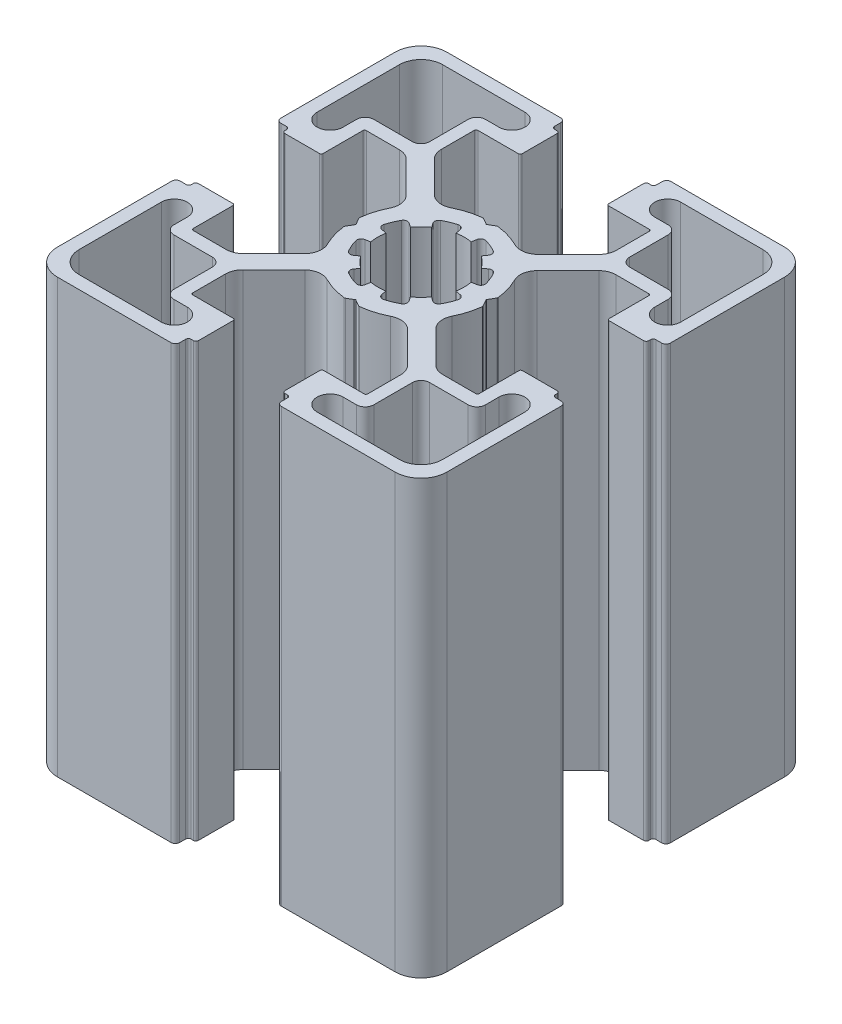
from build123d import *

# Parameters (mm, degrees)
BOSS_EXTRUDE1_DEPTH = 50


with BuildPart() as part:
    # Sketch1 → Boss-Extrude1 (new body)
    with BuildSketch(Plane(origin=(0, 0, 0), x_dir=(1, 0, 0), z_dir=(0, 1, 0))):
        with BuildLine():
            Line((7.563483841, 5.858695924), (11.129779796, 9.424987881))
            ThreePointArc((11.129779796, 9.424987881), (11.76062452, 9.846504465), (12.504756421, 9.994521395))
            Line((12.504756421, 9.994521395), (16.316902359, 9.994521395))
            ThreePointArc((16.316902359, 9.994521395), (16.458323963, 9.935942648), (16.51690271, 9.794521044))
            Line((16.51690271, 9.794521044), (16.51690271, 5.20001408))
            ThreePointArc((16.51690271, 5.20001408), (16.575481456, 5.058592476), (16.716903061, 5.000013729))
            Line((16.716903061, 5.000013729), (20.719599813, 5.000013729))
            ThreePointArc((20.719599813, 5.000013729), (20.931731335, 5.087881483), (21.019599089, 5.300013005))
            Line((21.019599089, 5.300013005), (21.019599089, 5.500003954))
            ThreePointArc((21.019599089, 5.500003954), (21.107466988, 5.71213583), (21.319598864, 5.800003729))
            Line((21.319598864, 5.800003729), (21.999979422, 5.800003729))
            ThreePointArc((21.999979422, 5.800003729), (22.353532548, 5.946450229), (22.499979048, 6.300003356))
            Line((22.499979048, 6.300003356), (22.499979048, 19.500015971))
            ThreePointArc((22.499979048, 19.500015971), (21.621300048, 21.62133473), (19.499981289, 22.50001373))
            Line((19.499981289, 22.50001373), (6.37570892, 22.50001373))
            ThreePointArc((6.37570892, 22.50001373), (6.022155794, 22.35356723), (5.875709294, 22.000014103))
            Line((5.875709294, 22.000014103), (5.875709294, 21.300013005))
            ThreePointArc((5.875709294, 21.300013005), (5.78784154, 21.087881482), (5.575710018, 21.000013729))
            Line((5.575710018, 21.000013729), (5.299998684, 21.000013729))
            ThreePointArc((5.299998684, 21.000013729), (5.087867516, 20.912146122), (4.999999909, 20.700014953))
            Line((4.999999909, 20.700014953), (4.999999909, 16.666812288))
            ThreePointArc((4.999999909, 16.666812288), (5.058578802, 16.52539033), (5.20000076, 16.466811437))
            Line((5.20000076, 16.466811437), (9.905385127, 16.466811437))
            ThreePointArc((9.905385127, 16.466811437), (10.046806731, 16.408232691), (10.105385478, 16.266811086))
            Line((10.105385478, 16.266811086), (10.105385478, 12.471582811))
            ThreePointArc((10.105385478, 12.471582811), (9.953144497, 11.706215717), (9.519598864, 11.057368824))
            Line((9.519598864, 11.057368824), (5.944897897, 7.482667857))
            ThreePointArc((5.944897897, 7.482667857), (4.854602604, 6.96783564), (3.666501718, 7.17329201))
            ThreePointArc((3.666501718, 7.17329201), (2.308631207, 7.714000899), (0.875344921, 8.000128222))
            ThreePointArc((0.875344921, 8.000128222), (0.813048151, 7.996979672), (0.754751151, 7.974792726))
            Line((0.754751151, 7.974792726), (0.112630526, 7.606936313))
            ThreePointArc((0.112630526, 7.606936313), (0.062965968, 7.559088119), (2.065e-06, 7.530953356))
            ThreePointArc((2.065e-06, 7.530953356), (-0.062961837, 7.559088119), (-0.112626394, 7.606936313))
            Line((-0.112626394, 7.606936313), (-0.754745572, 7.974791896))
            ThreePointArc((-0.754745572, 7.974791896), (-0.813042564, 7.99697884), (-0.875339325, 8.000127394))
            ThreePointArc((-0.875339325, 8.000127394), (-2.308625867, 7.714000103), (-3.666496612, 7.173291142))
            ThreePointArc((-3.666496612, 7.173291142), (-4.854599203, 6.967834938), (-5.944895348, 7.482669215))
            Line((-5.944895348, 7.482669215), (-9.519596331, 11.057370197))
            ThreePointArc((-9.519596331, 11.057370197), (-9.953141964, 11.70621709), (-10.105382945, 12.471584185))
            Line((-10.105382945, 12.471584185), (-10.105382945, 16.266811086))
            ThreePointArc((-10.105382945, 16.266811086), (-10.046804198, 16.408232691), (-9.905382594, 16.466811437))
            Line((-9.905382594, 16.466811437), (-5.200000942, 16.466811437))
            ThreePointArc((-5.200000942, 16.466811437), (-5.058578984, 16.52539033), (-5.000000091, 16.666812288))
            Line((-5.000000091, 16.666812288), (-5.000000091, 20.700014953))
            ThreePointArc((-5.000000091, 20.700014953), (-5.087867699, 20.912146122), (-5.299998867, 21.000013729))
            Line((-5.299998867, 21.000013729), (-5.575710202, 21.000013729))
            ThreePointArc((-5.575710202, 21.000013729), (-5.787841724, 21.087881482), (-5.875709478, 21.300013005))
            Line((-5.875709478, 21.300013005), (-5.875709478, 22.000014104))
            ThreePointArc((-5.875709478, 22.000014104), (-6.022155978, 22.35356723), (-6.375709104, 22.50001373))
            Line((-6.375709104, 22.50001373), (-19.499981473, 22.50001373))
            ThreePointArc((-19.499981473, 22.50001373), (-21.621300232, 21.62133473), (-22.499979232, 19.500015971))
            Line((-22.499979232, 19.500015971), (-22.499979232, 6.300003356))
            ThreePointArc((-22.499979232, 6.300003356), (-22.353532732, 5.946450229), (-21.999979605, 5.800003729))
            Line((-21.999979605, 5.800003729), (-21.319599047, 5.800003729))
            ThreePointArc((-21.319599047, 5.800003729), (-21.107467171, 5.71213583), (-21.019599271, 5.500003954))
            Line((-21.019599271, 5.500003954), (-21.019599271, 5.300013005))
            ThreePointArc((-21.019599271, 5.300013005), (-20.931731518, 5.087881483), (-20.719599995, 5.000013729))
            Line((-20.719599995, 5.000013729), (-16.716903244, 5.000013729))
            ThreePointArc((-16.716903244, 5.000013729), (-16.57548164, 5.058592476), (-16.516902894, 5.20001408))
            Line((-16.516902894, 5.20001408), (-16.516902894, 9.794521044))
            ThreePointArc((-16.516902894, 9.794521044), (-16.458324147, 9.935942648), (-16.316902543, 9.994521395))
            Line((-16.316902543, 9.994521395), (-12.504755574, 9.994521395))
            ThreePointArc((-12.504755574, 9.994521395), (-11.760623673, 9.846504465), (-11.129778949, 9.424987881))
            Line((-11.129778949, 9.424987881), (-7.563484024, 5.858696956))
            ThreePointArc((-7.563484024, 5.858696956), (-7.018857309, 4.793955357), (-7.200363541, 3.611860429))
            ThreePointArc((-7.200363541, 3.611860429), (-7.719534914, 2.299057702), (-7.999860794, 0.915436613))
            ThreePointArc((-7.999860794, 0.915436613), (-7.996805132, 0.851929863), (-7.97397167, 0.792591196))
            Line((-7.97397167, 0.792591196), (-7.540055962, 0.046829926))
            ThreePointArc((-7.540055962, 0.046829926), (-7.534291471, 0.023676009), (-7.531325428, 3.7e-07))
            ThreePointArc((-7.531325428, 3.7e-07), (-7.534291471, -0.023675268), (-7.540055962, -0.046829185))
            Line((-7.540055962, -0.046829185), (-7.97397167, -0.792590455))
            ThreePointArc((-7.97397167, -0.792590455), (-7.996805132, -0.851929122), (-7.999860794, -0.915435872))
            ThreePointArc((-7.999860794, -0.915435872), (-7.719534914, -2.299056961), (-7.200363541, -3.611859688))
            ThreePointArc((-7.200363541, -3.611859688), (-7.018857309, -4.793954616), (-7.563484024, -5.858696215))
            Line((-7.563484024, -5.858696215), (-11.12977998, -9.424988171))
            ThreePointArc((-11.12977998, -9.424988171), (-11.760624704, -9.846504756), (-12.504756605, -9.994521685))
            Line((-12.504756605, -9.994521685), (-16.316902543, -9.994521685))
            ThreePointArc((-16.316902543, -9.994521685), (-16.458324147, -9.935942938), (-16.516902894, -9.794521334))
            Line((-16.516902894, -9.794521334), (-16.516902894, -5.200014371))
            ThreePointArc((-16.516902894, -5.200014371), (-16.57548164, -5.058592767), (-16.716903244, -5.000014021))
            Line((-16.716903244, -5.000014021), (-20.719599995, -5.000014021))
            ThreePointArc((-20.719599995, -5.000014021), (-20.931731518, -5.087881774), (-21.019599271, -5.300013296))
            Line((-21.019599271, -5.300013296), (-21.019599271, -5.500004245))
            ThreePointArc((-21.019599271, -5.500004245), (-21.107467171, -5.71213612), (-21.319599047, -5.80000402))
            Line((-21.319599047, -5.80000402), (-21.999979605, -5.80000402))
            ThreePointArc((-21.999979605, -5.80000402), (-22.353532732, -5.94645052), (-22.499979232, -6.300003647))
            Line((-22.499979232, -6.300003647), (-22.499979232, -19.500016261))
            ThreePointArc((-22.499979232, -19.500016261), (-21.621300232, -21.62133502), (-19.499981473, -22.50001402))
            Line((-19.499981473, -22.50001402), (-6.375709104, -22.50001402))
            ThreePointArc((-6.375709104, -22.50001402), (-6.022155978, -22.35356752), (-5.875709478, -22.000014394))
            Line((-5.875709478, -22.000014394), (-5.875709478, -21.300013295))
            ThreePointArc((-5.875709478, -21.300013295), (-5.787841724, -21.087881773), (-5.575710202, -21.000014019))
            Line((-5.575710202, -21.000014019), (-5.299998867, -21.000014019))
            ThreePointArc((-5.299998867, -21.000014019), (-5.087867699, -20.912146412), (-5.000000091, -20.700015244))
            Line((-5.000000091, -20.700015244), (-5.000000091, -16.666812578))
            ThreePointArc((-5.000000091, -16.666812578), (-5.058578984, -16.52539062), (-5.200000942, -16.466811727))
            Line((-5.200000942, -16.466811727), (-9.905382594, -16.466811727))
            ThreePointArc((-9.905382594, -16.466811727), (-10.046804198, -16.40823298), (-10.105382945, -16.266811376))
            Line((-10.105382945, -16.266811376), (-10.105382945, -12.471581681))
            ThreePointArc((-10.105382945, -12.471581681), (-9.953141964, -11.706214586), (-9.519596331, -11.057367693))
            Line((-9.519596331, -11.057367693), (-5.944895364, -7.482666726))
            ThreePointArc((-5.944895364, -7.482666726), (-4.854601518, -6.967832762), (-3.66650075, -7.173286521))
            ThreePointArc((-3.66650075, -7.173286521), (-2.30862839, -7.713996836), (-0.875339942, -8.000124808))
            ThreePointArc((-0.875339942, -8.000124808), (-0.81304361, -7.99697628), (-0.754747019, -7.97478949))
            Line((-0.754747019, -7.97478949), (-0.112626395, -7.606933078))
            ThreePointArc((-0.112626395, -7.606933078), (-0.062961838, -7.559084884), (2.065e-06, -7.530950121))
            ThreePointArc((2.065e-06, -7.530950121), (0.062965968, -7.559084884), (0.112630526, -7.606933078))
            Line((0.112630526, -7.606933078), (0.754751151, -7.974789491))
            ThreePointArc((0.754751151, -7.974789491), (0.813048151, -7.996976437), (0.875344921, -8.000124987))
            ThreePointArc((0.875344921, -8.000124987), (2.308629801, -7.71399808), (3.666499103, -7.173290103))
            ThreePointArc((3.666499103, -7.173290103), (4.854601719, -6.967833865), (5.944897897, -7.482668146))
            Line((5.944897897, -7.482668146), (9.519598864, -11.057369113))
            ThreePointArc((9.519598864, -11.057369113), (9.953144497, -11.706216006), (10.105385478, -12.471583101))
            Line((10.105385478, -12.471583101), (10.105385478, -16.266811376))
            ThreePointArc((10.105385478, -16.266811376), (10.046806731, -16.40823298), (9.905385127, -16.466811727))
            Line((9.905385127, -16.466811727), (5.20000076, -16.466811727))
            ThreePointArc((5.20000076, -16.466811727), (5.058578802, -16.52539062), (4.999999909, -16.666812578))
            Line((4.999999909, -16.666812578), (4.999999909, -20.700015244))
            ThreePointArc((4.999999909, -20.700015244), (5.087867516, -20.912146412), (5.299998684, -21.000014019))
            Line((5.299998684, -21.000014019), (5.575710018, -21.000014019))
            ThreePointArc((5.575710018, -21.000014019), (5.78784154, -21.087881773), (5.875709294, -21.300013295))
            Line((5.875709294, -21.300013295), (5.875709294, -22.000014394))
            ThreePointArc((5.875709294, -22.000014394), (6.022155794, -22.35356752), (6.37570892, -22.50001402))
            Line((6.37570892, -22.50001402), (19.499981289, -22.50001402))
            ThreePointArc((19.499981289, -22.50001402), (21.621300048, -21.62133502), (22.499979048, -19.500016261))
            Line((22.499979048, -19.500016261), (22.499979048, -6.300003646))
            ThreePointArc((22.499979048, -6.300003646), (22.353532548, -5.94645052), (21.999979422, -5.80000402))
            Line((21.999979422, -5.80000402), (21.319598864, -5.80000402))
            ThreePointArc((21.319598864, -5.80000402), (21.107466988, -5.71213612), (21.019599089, -5.500004245))
            Line((21.019599089, -5.500004245), (21.019599089, -5.300013297))
            ThreePointArc((21.019599089, -5.300013297), (20.931731335, -5.087881774), (20.719599813, -5.000014021))
            Line((20.719599813, -5.000014021), (16.716903061, -5.000014021))
            ThreePointArc((16.716903061, -5.000014021), (16.575481456, -5.058592767), (16.51690271, -5.200014371))
            Line((16.51690271, -5.200014371), (16.51690271, -9.794521334))
            ThreePointArc((16.51690271, -9.794521334), (16.458323963, -9.935942938), (16.316902359, -9.994521685))
            Line((16.316902359, -9.994521685), (12.504756421, -9.994521685))
            ThreePointArc((12.504756421, -9.994521685), (11.76062452, -9.846504756), (11.129779797, -9.424988171))
            Line((11.129779797, -9.424988171), (7.56348384, -5.858696215))
            ThreePointArc((7.56348384, -5.858696215), (7.018857125, -4.793954616), (7.200363357, -3.611859689))
            ThreePointArc((7.200363357, -3.611859689), (7.71953473, -2.299056961), (7.99986061, -0.915435872))
            ThreePointArc((7.99986061, -0.915435872), (7.996804948, -0.851929122), (7.973971486, -0.792590456))
            Line((7.973971486, -0.792590456), (7.54005578, -0.046829188))
            ThreePointArc((7.54005578, -0.046829188), (7.53429135, -0.023675779), (7.531325245, -6.6e-07))
            ThreePointArc((7.531325245, -6.6e-07), (7.534291289, 0.023674979), (7.54005578, 0.046828898))
            Line((7.54005578, 0.046828898), (7.973971486, 0.792590166))
            ThreePointArc((7.973971486, 0.792590166), (7.996804949, 0.851928832), (7.99986061, 0.915435582))
            ThreePointArc((7.99986061, 0.915435582), (7.719534731, 2.299056671), (7.200363358, 3.611859399))
            ThreePointArc((7.200363358, 3.611859399), (7.018857126, 4.793954326), (7.563483841, 5.858695924))
        make_face()
        with BuildLine():
            Line((-17.99997923, 9.000204729), (-17.99997923, 10.550013476))
            ThreePointArc((-17.99997923, 10.550013476), (-17.70708623, 11.257119729), (-16.999979977, 11.550012729))
            Line((-16.999979977, 11.550012729), (-12.549977483, 11.550012729))
            ThreePointArc((-12.549977483, 11.550012729), (-11.84287123, 11.842905729), (-11.54997823, 12.550011982))
            Line((-11.54997823, 12.550011982), (-11.54997823, 17.000014476))
            ThreePointArc((-11.54997823, 17.000014476), (-11.25708523, 17.707120729), (-10.549978977, 18.000013729))
            Line((-10.549978977, 18.000013729), (-8.99997923, 18.000013729))
            ThreePointArc((-8.99997923, 18.000013729), (-7.49997923, 19.500013729), (-8.99997923, 21.000013729))
            Line((-8.99997923, 21.000013729), (-18.499981098, 21.000013729))
            ThreePointArc((-18.499981098, 21.000013729), (-20.26774673, 20.267781229), (-20.99997923, 18.500015597))
            Line((-20.99997923, 18.500015597), (-20.99997923, 9.000204729))
            ThreePointArc((-20.99997923, 9.000204729), (-19.49997923, 7.500204729), (-17.99997923, 9.000204729))
        make_face(mode=Mode.SUBTRACT)
        with BuildLine():
            Line((0.967518273, 5.481094418), (0.867385333, 4.924170439))
            ThreePointArc((0.867385333, 4.924170439), (-3.404e-06, 4.999981493), (-0.867392141, 4.924170439))
            Line((-0.867392141, 4.924170439), (-0.967525085, 5.48109443))
            ThreePointArc((-0.967525085, 5.48109443), (-1.18787304, 5.829596016), (-1.595121059, 5.894060173))
            ThreePointArc((-1.595121059, 5.894060173), (-2.337474987, 5.644060679), (-3.0416713, 5.300991221))
            ThreePointArc((-3.0416713, 5.300991221), (-3.284300912, 4.965857552), (-3.191387249, 4.562681715))
            Line((-3.191387249, 4.562681715), (-2.864003826, 4.098457013))
            ThreePointArc((-2.864003826, 4.098457013), (-3.530136355, 3.540908116), (-4.089716295, 2.876480837))
            Line((-4.089716295, 2.876480837), (-4.566781049, 3.208143991))
            ThreePointArc((-4.566781049, 3.208143991), (-4.968981864, 3.298752353), (-5.302521511, 3.056416481))
            ThreePointArc((-5.302521511, 3.056416481), (-5.650679971, 2.354692469), (-5.906040083, 1.614137194))
            ThreePointArc((-5.906040083, 1.614137194), (-5.840630787, 1.205603075), (-5.48985103, 0.986212864))
            Line((-5.48985103, 0.986212864), (-4.920549171, 0.887804317))
            ThreePointArc((-4.920549171, 0.887804317), (-5.000003405, -1.8509e-05), (-4.92054917, -0.887841334))
            Line((-4.92054917, -0.887841334), (-5.48973413, -0.986229672))
            ThreePointArc((-5.48973413, -0.986229672), (-5.84059179, -1.205595835), (-5.906027737, -1.614179668))
            ThreePointArc((-5.906027737, -1.614179668), (-5.650660878, -2.354735576), (-5.302495324, -3.056459191))
            ThreePointArc((-5.302495324, -3.056459191), (-4.968965627, -3.298777294), (-4.566781049, -3.208181006))
            Line((-4.566781049, -3.208181006), (-4.089716295, -2.876517852))
            ThreePointArc((-4.089716295, -2.876517852), (-3.530136355, -3.540945131), (-2.864003826, -4.098494028))
            Line((-2.864003826, -4.098494028), (-3.191315305, -4.562616715))
            ThreePointArc((-3.191315305, -4.562616715), (-3.284288314, -4.9658247), (-3.041645074, -5.301003633))
            ThreePointArc((-3.041645074, -5.301003633), (-2.337436005, -5.644074141), (-1.595068803, -5.894071587))
            ThreePointArc((-1.595068803, -5.894071587), (-1.187863583, -5.829591875), (-0.967525085, -5.481131446))
            Line((-0.967525085, -5.481131446), (-0.867392142, -4.924207454))
            ThreePointArc((-0.867392142, -4.924207454), (-3.405e-06, -5.000018508), (0.867385333, -4.924207454))
            Line((0.867385333, -4.924207454), (0.967518273, -5.481131433))
            ThreePointArc((0.967518273, -5.481131433), (1.187884068, -5.829612183), (1.595127065, -5.894056407))
            ThreePointArc((1.595127065, -5.894056407), (2.337463214, -5.64406402), (3.04164388, -5.301006091))
            ThreePointArc((3.04164388, -5.301006091), (3.284272431, -4.965888777), (3.191382531, -4.562721697))
            Line((3.191382531, -4.562721697), (2.863997017, -4.098494027))
            ThreePointArc((2.863997017, -4.098494027), (3.530129546, -3.540945131), (4.089709486, -2.876517851))
            Line((4.089709486, -2.876517851), (4.56677425, -3.208181013))
            ThreePointArc((4.56677425, -3.208181013), (4.968991235, -3.298778206), (5.302526078, -3.056413061))
            ThreePointArc((5.302526078, -3.056413061), (5.650679647, -2.354700627), (5.90603791, -1.614157983))
            ThreePointArc((5.90603791, -1.614157983), (5.840629826, -1.205623017), (5.489849863, -0.98623192))
            Line((5.489849863, -0.98623192), (4.920545674, -0.88782297))
            ThreePointArc((4.920545674, -0.88782297), (4.999996595, -1.94e-07), (4.92053917, 0.887822))
            Line((4.92053917, 0.887822), (5.489724104, 0.986210336))
            ThreePointArc((5.489724104, 0.986210336), (5.840595493, 1.20557008), (5.90603791, 1.614161218))
            ThreePointArc((5.90603791, 1.614161218), (5.650669489, 2.354728137), (5.302499707, 3.056461843))
            ThreePointArc((5.302499707, 3.056461843), (4.968955649, 3.298763634), (4.56677425, 3.208143998))
            Line((4.56677425, 3.208143998), (4.089709486, 2.876480836))
            ThreePointArc((4.089709486, 2.876480836), (3.530129546, 3.540908115), (2.863997017, 4.098457012))
            Line((2.863997017, 4.098457012), (3.191308496, 4.562579701))
            ThreePointArc((3.191308496, 4.562579701), (3.284310107, 4.965799272), (3.041663899, 5.300997928))
            ThreePointArc((3.041663899, 5.300997928), (2.337448292, 5.644073372), (1.595073641, 5.894073887))
            ThreePointArc((1.595073641, 5.894073887), (1.18784779, 5.829586125), (0.967518273, 5.481094418))
        make_face(mode=Mode.SUBTRACT)
        with BuildLine():
            Line((-20.99997923, -9.000205019), (-20.99997923, -18.500015887))
            ThreePointArc((-20.99997923, -18.500015887), (-20.26774673, -20.267781519), (-18.499981098, -21.000014019))
            Line((-18.499981098, -21.000014019), (-8.99997923, -21.000014019))
            ThreePointArc((-8.99997923, -21.000014019), (-7.49997923, -19.500014019), (-8.99997923, -18.000014019))
            Line((-8.99997923, -18.000014019), (-10.549978977, -18.000014019))
            ThreePointArc((-10.549978977, -18.000014019), (-11.25708523, -17.707121019), (-11.54997823, -17.000014766))
            Line((-11.54997823, -17.000014766), (-11.54997823, -12.550012272))
            ThreePointArc((-11.54997823, -12.550012272), (-11.84287123, -11.842906019), (-12.549977483, -11.550013019))
            Line((-12.549977483, -11.550013019), (-16.999979977, -11.550013019))
            ThreePointArc((-16.999979977, -11.550013019), (-17.70708623, -11.257120019), (-17.99997923, -10.550013766))
            Line((-17.99997923, -10.550013766), (-17.99997923, -9.000205019))
            ThreePointArc((-17.99997923, -9.000205019), (-19.49997923, -7.500205019), (-20.99997923, -9.000205019))
        make_face(mode=Mode.SUBTRACT)
        with BuildLine():
            Line((20.999979046, 9.000204729), (20.999979046, 18.500015597))
            ThreePointArc((20.999979046, 18.500015597), (20.267746546, 20.267781229), (18.499980914, 21.000013729))
            Line((18.499980914, 21.000013729), (8.999979046, 21.000013729))
            ThreePointArc((8.999979046, 21.000013729), (7.499979046, 19.500013729), (8.999979046, 18.000013729))
            Line((8.999979046, 18.000013729), (10.549978793, 18.000013729))
            ThreePointArc((10.549978793, 18.000013729), (11.257085046, 17.707120729), (11.549978046, 17.000014476))
            Line((11.549978046, 17.000014476), (11.549978046, 12.550011982))
            ThreePointArc((11.549978046, 12.550011982), (11.842871046, 11.842905729), (12.549977299, 11.550012729))
            Line((12.549977299, 11.550012729), (16.999979793, 11.550012729))
            ThreePointArc((16.999979793, 11.550012729), (17.707086046, 11.257119729), (17.999979046, 10.550013476))
            Line((17.999979046, 10.550013476), (17.999979046, 9.000204729))
            ThreePointArc((17.999979046, 9.000204729), (19.499979046, 7.500204729), (20.999979046, 9.000204729))
        make_face(mode=Mode.SUBTRACT)
        with BuildLine():
            Line((16.999979793, -11.550013019), (12.549977299, -11.550013019))
            ThreePointArc((12.549977299, -11.550013019), (11.842871046, -11.842906019), (11.549978046, -12.550012272))
            Line((11.549978046, -12.550012272), (11.549978046, -17.000014766))
            ThreePointArc((11.549978046, -17.000014766), (11.257085046, -17.707121019), (10.549978793, -18.000014019))
            Line((10.549978793, -18.000014019), (8.999979046, -18.000014019))
            ThreePointArc((8.999979046, -18.000014019), (7.499979046, -19.500014019), (8.999979046, -21.000014019))
            Line((8.999979046, -21.000014019), (18.499980914, -21.000014019))
            ThreePointArc((18.499980914, -21.000014019), (20.267746546, -20.267781519), (20.999979046, -18.500015887))
            Line((20.999979046, -18.500015887), (20.999979046, -9.000205019))
            ThreePointArc((20.999979046, -9.000205019), (19.499979046, -7.500205019), (17.999979046, -9.000205019))
            Line((17.999979046, -9.000205019), (17.999979046, -10.550013766))
            ThreePointArc((17.999979046, -10.550013766), (17.707086046, -11.257120019), (16.999979793, -11.550013019))
        make_face(mode=Mode.SUBTRACT)
    extrude(amount=BOSS_EXTRUDE1_DEPTH)


solid = part.part
